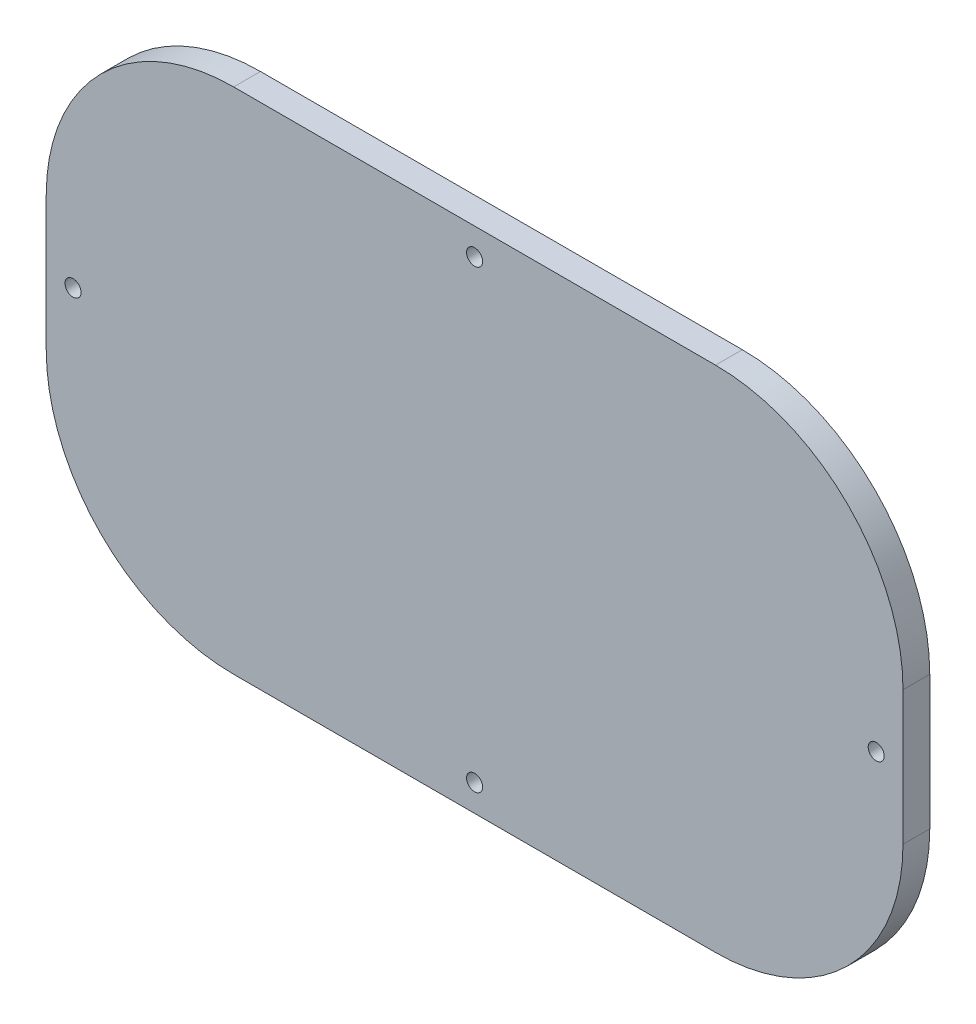
from build123d import *

# Parameters (mm, degrees)
ESQUISSE1_R        = 1.5
BOSS_EXTRU_1_DEPTH = 5


with BuildPart() as part:
    # Esquisse1 → Boss.-Extru.1 (new body)
    with BuildSketch(Plane.XY):
        with BuildLine():
            Line((46.10804395, 47.084483519), (-43.89195605, 47.084483519))
            ThreePointArc((-43.89195605, 47.084483519), (-68.640693391, 36.83322086), (-78.89195605, 12.084483519))
            Line((-78.89195605, 12.084483519), (-78.89195605, -12.915516481))
            ThreePointArc((-78.89195605, -12.915516481), (-68.640693391, -37.664253823), (-43.89195605, -47.915516481))
            Line((-43.89195605, -47.915516481), (46.10804395, -47.915516481))
            ThreePointArc((46.10804395, -47.915516481), (70.856781292, -37.664253823), (81.10804395, -12.915516481))
            Line((81.10804395, -12.915516481), (81.10804395, 12.084483519))
            ThreePointArc((81.10804395, 12.084483519), (70.856781292, 36.83322086), (46.10804395, 47.084483519))
        make_face()
        with Locations((-73.89195605, -0.415516481)):
            Circle(ESQUISSE1_R, mode=Mode.SUBTRACT)
        with Locations(Location((76.10804395, -0.415516481, 0), (0, 0, 180))):
            Circle(ESQUISSE1_R, mode=Mode.SUBTRACT)
        with Locations((1.10804395, 42.084483519)):
            Circle(ESQUISSE1_R, mode=Mode.SUBTRACT)
        with Locations((1.10804395, -42.915516481)):
            Circle(ESQUISSE1_R, mode=Mode.SUBTRACT)
    extrude(amount=BOSS_EXTRU_1_DEPTH)


solid = part.part
